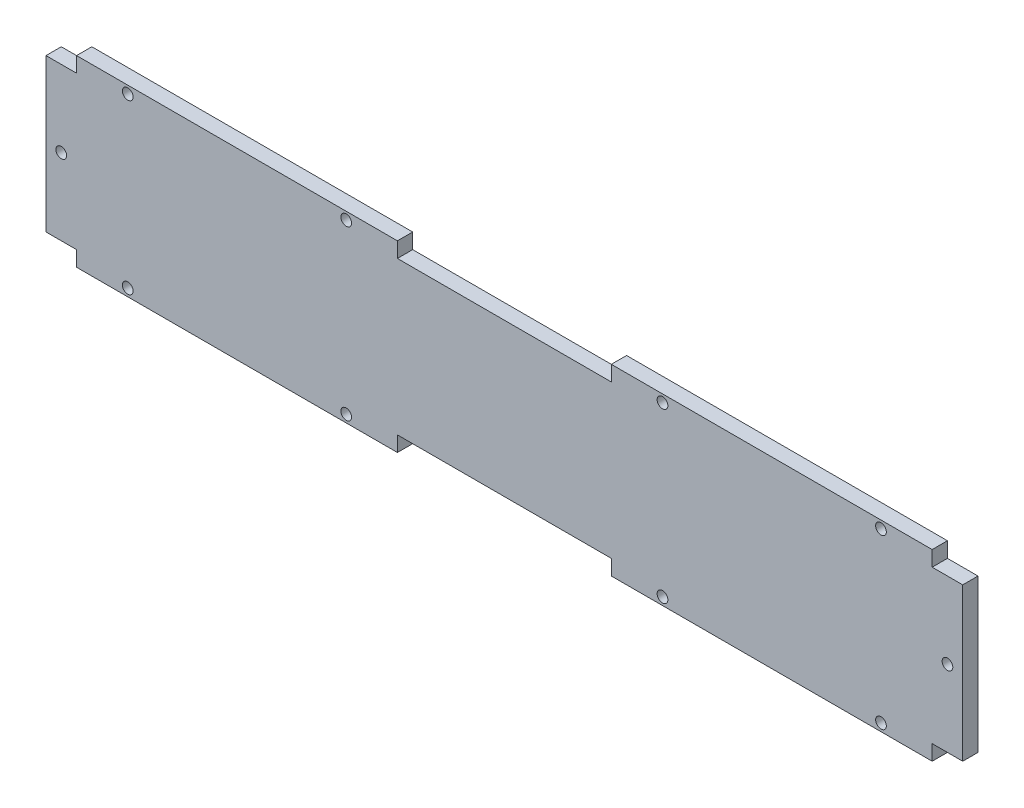
from build123d import *

# Parameters (mm, degrees)
SKETCH1_W           = 105
SKETCH1_H           = 5
SKETCH1_W_2         = 10
SKETCH1_H_2         = 50
BOSS_EXTRUDE1_DEPTH = 5
SKETCH2_R           = 1.75
CUT_EXTRUDE1_DEPTH  = 5
SKETCH3_R           = 1.75
CUT_EXTRUDE2_DEPTH  = 10


with BuildPart() as part:
    # Sketch1 → Boss-Extrude1 (new body)
    with BuildSketch(Plane.XY):
        Polygon((-35, 0), (0, 0), (0, 50), (-35, 50), (-140, 50), (-140, 0), align=None)
        Polygon((0, 50), (0, 0), (35, 0), (140, 0), (140, 50), (35, 50), align=None)
        with Locations((-87.5, -2.5)):
            Rectangle(SKETCH1_W, SKETCH1_H)
        with Locations((87.5, -2.5)):
            Rectangle(SKETCH1_W, SKETCH1_H)
        with Locations((-87.5, 52.5)):
            Rectangle(SKETCH1_W, SKETCH1_H)
        with Locations((87.5, 52.5)):
            Rectangle(SKETCH1_W, SKETCH1_H)
        with Locations((-145, 25)):
            Rectangle(SKETCH1_W_2, SKETCH1_H_2)
        with Locations((145, 25)):
            Rectangle(SKETCH1_W_2, SKETCH1_H_2)
    extrude(amount=BOSS_EXTRUDE1_DEPTH)

    # Sketch2 → Cut-Extrude1 (cut)
    with BuildSketch(Plane.XY.offset(5)):
        with Locations((-123.25, -2.5)):
            Circle(SKETCH2_R)
        with Locations(Location((-51.75, -2.5, 0), (0, 0, 180))):
            Circle(SKETCH2_R)
        with Locations((51.75, -2.5)):
            Circle(SKETCH2_R)
        with Locations(Location((123.25, -2.5, 0), (0, 0, 180))):
            Circle(SKETCH2_R)
        with Locations((123.25, 52.5)):
            Circle(SKETCH2_R)
        with Locations(Location((51.75, 52.5, 0), (0, 0, 180))):
            Circle(SKETCH2_R)
        with Locations((-51.75, 52.5)):
            Circle(SKETCH2_R)
        with Locations(Location((-123.25, 52.5, 0), (0, 0, 180))):
            Circle(SKETCH2_R)
    extrude(amount=-CUT_EXTRUDE1_DEPTH, mode=Mode.SUBTRACT)

    # Sketch3 → Cut-Extrude2 (cut)
    with BuildSketch(Plane.XY.offset(5)):
        with Locations((-145, 25)):
            Circle(SKETCH3_R)
        with Locations((145, 25)):
            Circle(SKETCH3_R)
    extrude(amount=-CUT_EXTRUDE2_DEPTH, mode=Mode.SUBTRACT)


solid = part.part
